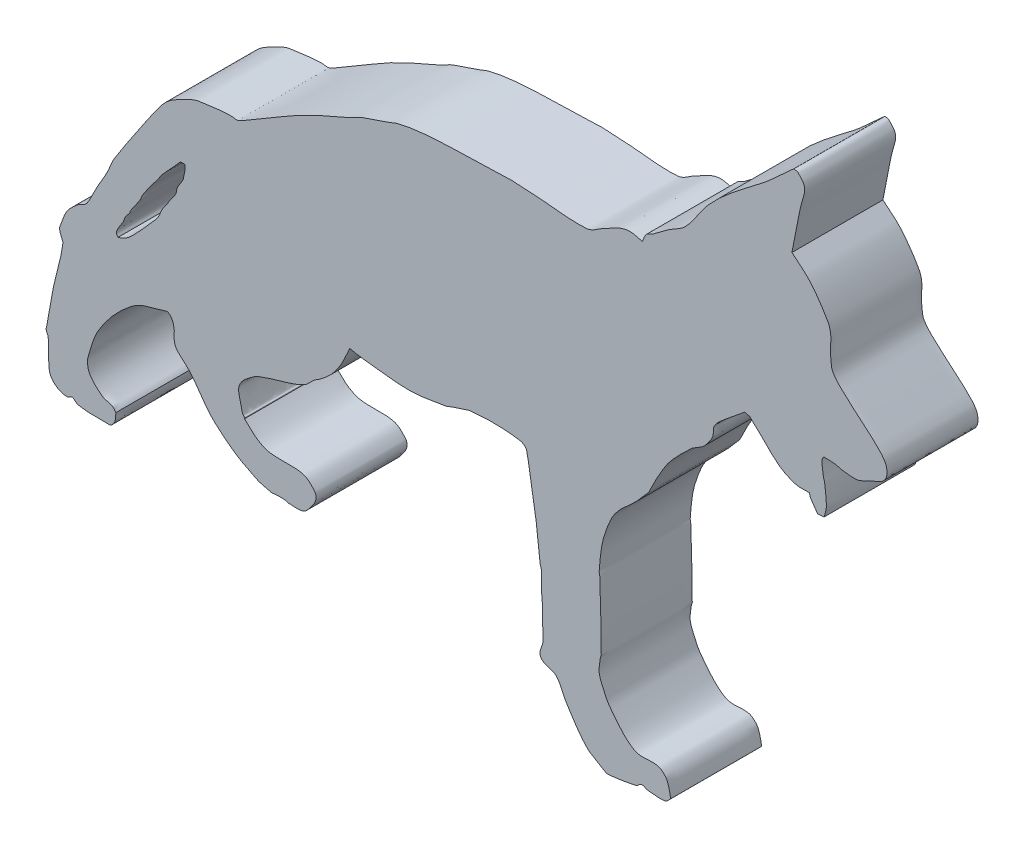
from build123d import *

# Parameters (mm, degrees)
BOSS_EXTRUDE1_DEPTH     = 5
CUT_EXTRUDE1_DEPTH      = 63.844645936
CUT_EXTRUDE1_DEPTH_BACK = 5


with BuildPart() as part:
    # Sketch1 → Boss-Extrude1 (new body)
    with BuildSketch(Plane.XY):
        with BuildLine():
            add(Edge.make_bspline(
                [(7.070233289, 8.254419397), (7.045233289, 8.089419397), (7.069865722, 7.908684262), (6.995233289, 7.759419397), (6.931908728, 7.632770275), (6.81861456, 7.504429793), (6.680233289, 7.474419397), (4.627595112, 7.029268949), (6.124293611, 7.44484249), (5.690233289, 7.504419397), (5.455526628, 7.536634036), (5.212242229, 7.526655534), (4.985233289, 7.594419397), (4.868267752, 7.629334482), (4.785233289, 7.734419397), (4.685233289, 7.804419397)],
                knots=[0, 0, 0, 0, 1, 1, 1, 2, 2, 2, 3, 3, 3, 4, 4, 4, 5, 5, 5, 5], degree=3))
            add(Edge.make_bspline(
                [(4.685233289, 7.804419397), (4.580233289, 7.759419397), (4.484469886, 7.669419397), (4.370233289, 7.669419397), (4.204025588, 7.669419397), (4.032114712, 7.717847681), (3.890233289, 7.804419397), (3.727257476, 7.903862266), (3.572665826, 8.039697414), (3.485233289, 8.209419397), (3.394504703, 8.385539593), (3.395428102, 8.596886823), (3.380233289, 8.794419397), (3.350311823, 9.183398452), (3.388671895, 9.576189473), (3.350233289, 9.964419397), (3.338236704, 10.085584911), (3.253369968, 10.189879888), (3.230233289, 10.309419397), (3.222398485, 10.349899217), (3.252784836, 10.388866708), (3.260233289, 10.429419397), (3.387800639, 11.123952744), (3.508913061, 11.819658143), (3.635233289, 12.514419397), (3.638921107, 12.534702394), (3.645801384, 12.554285887), (3.650233289, 12.574419397), (3.820803206, 13.349294163), (4.071731027, 14.110944698), (4.160233289, 14.899419397), (4.164455373, 14.937034326), (3.910088632, 15.364832547), (3.995233289, 15.574419397), (4.117555829, 15.875521034), (4.193676624, 16.201559095), (4.370233289, 16.474419397), (4.529661574, 16.720808564), (4.761319854, 16.914714959), (4.985233289, 17.104419397), (5.123941211, 17.221935831), (5.337915438, 17.246469404), (5.450233289, 17.389419397), (5.678283937, 17.679665675), (5.796172568, 18.041638886), (5.975233289, 18.364419397), (6.176199178, 18.726686855), (6.397734724, 19.077582508), (6.590233289, 19.444419397), (6.735788265, 19.721797747), (6.815140099, 20.033206627), (6.980233289, 20.299419397), (7.298173363, 20.812097765), (7.633279255, 21.314032567), (7.970233289, 21.814419397), (8.468333303, 22.55411283), (8.952663715, 23.304143472), (9.485233289, 24.019419397), (9.639383145, 24.22645278), (9.820195083, 24.417625474), (10.025233289, 24.574419397), (10.249384405, 24.745829073), (10.508923167, 24.866090824), (10.760233289, 24.994419397), (11.052135873, 25.143476035), (11.349738226, 25.315975098), (11.675233289, 25.354419397), (12.249364544, 25.422230175), (12.82211133, 25.534419397), (13.400233289, 25.534419397), (13.530329407, 25.534419397), (13.668235815, 25.474235147), (13.790233289, 25.519419397), (14.086256081, 25.629057468), (14.340590008, 25.828788204), (14.615233289, 25.984419397), (14.940591344, 26.168788961), (15.266410491, 26.352366476), (15.590233289, 26.539419397), (16.071421338, 26.817372741), (16.538889007, 27.119841285), (17.030233289, 27.379419397), (17.599697762, 27.680268552), (18.185373669, 27.949717292), (18.770233289, 28.219419397), (19.150605648, 28.394824267), (19.545012163, 28.538686943), (19.925233289, 28.714419397), (20.140426079, 28.813878249), (20.334682299, 28.95748689), (20.555233289, 29.044419397), (21.021540661, 29.228219383), (21.507259458, 29.35852559), (21.980233289, 29.524419397), (22.177383756, 29.593569187), (22.362351335, 29.699530392), (22.565233289, 29.749419397), (23.445125525, 29.96578634), (24.359866542, 30.027867323), (25.265233289, 30.064419397), (26.38986143, 30.109823638), (27.515375166, 30.130123043), (28.640233289, 30.169419397), (28.660836249, 30.170139151), (28.679632992, 30.185211716), (28.700233289, 30.184419397), (29.220713127, 30.164400941), (29.740317369, 30.125842886), (30.260233289, 30.094419397), (31.150013002, 30.040641502), (32.042222834, 29.866718482), (32.930233289, 29.944419397), (33.275504604, 29.974630637), (33.551981083, 30.250972001), (33.860233289, 30.409419397), (34.087026304, 30.525995245), (34.306513715, 30.656670311), (34.535233289, 30.769419397), (34.66184163, 30.831831959), (34.789051143, 30.897278811), (34.925233289, 30.934419397), (35.066448482, 30.972932631), (35.214222089, 31.004701875), (35.360233289, 30.994419397), (35.574470026, 30.979332302), (35.780233289, 30.904419397), (35.990233289, 30.859419397)],
                knots=[0, 0, 0, 0, 1, 1, 1, 2, 2, 2, 3, 3, 3, 4, 4, 4, 5, 5, 5, 6, 6, 6, 7, 7, 7, 8, 8, 8, 9, 9, 9, 10, 10, 10, 11, 11, 11, 12, 12, 12, 13, 13, 13, 14, 14, 14, 15, 15, 15, 16, 16, 16, 17, 17, 17, 18, 18, 18, 19, 19, 19, 20, 20, 20, 21, 21, 21, 22, 22, 22, 23, 23, 23, 24, 24, 24, 25, 25, 25, 26, 26, 26, 27, 27, 27, 28, 28, 28, 29, 29, 29, 30, 30, 30, 31, 31, 31, 32, 32, 32, 33, 33, 33, 34, 34, 34, 35, 35, 35, 36, 36, 36, 37, 37, 37, 38, 38, 38, 39, 39, 39, 40, 40, 40, 41, 41, 41, 42, 42, 42, 42], degree=3))
            add(Edge.make_bspline(
                [(35.990233289, 30.859419397), (36.065233289, 31.009419397), (36.102566499, 31.185197038), (36.215233289, 31.309419397), (36.306918185, 31.410507872), (36.462533388, 31.42745361), (36.575233289, 31.504419397), (36.873352019, 31.708012675), (37.149135764, 31.942897593), (37.445233289, 32.149419397), (37.744382282, 32.358069534), (38.107648978, 32.486310739), (38.360233289, 32.749419397), (38.837389729, 33.246457355), (39.151713995, 33.880723677), (39.605233289, 34.399419397), (40.262833198, 35.151524682), (41.065353871, 35.767708268), (41.855233289, 36.379419397), (42.190506462, 36.639067042), (42.537566988, 36.884262244), (42.860233289, 37.159419397), (43.353133782, 37.579745584), (43.816072978, 38.034054676), (44.300233289, 38.464419397), (44.312050868, 38.474923911), (44.329998733, 38.483651218), (44.345233289, 38.479419397), (44.42306383, 38.457799802), (44.515381994, 38.448718094), (44.570233289, 38.389419397), (44.707728811, 38.240775589), (44.881715692, 38.081055451), (44.900233289, 37.879419397), (44.93574678, 37.492716937), (44.73639102, 37.120208052), (44.660233289, 36.739419397), (44.507586857, 35.976187238), (44.349533339, 35.210569669), (44.210233289, 34.444419397)],
                knots=[0, 0, 0, 0, 1, 1, 1, 2, 2, 2, 3, 3, 3, 4, 4, 4, 5, 5, 5, 6, 6, 6, 7, 7, 7, 8, 8, 8, 9, 9, 9, 10, 10, 10, 11, 11, 11, 12, 12, 12, 13, 13, 13, 13], degree=3))
            add(Edge.make_bspline(
                [(44.210233289, 34.444419397), (44.540233289, 34.149419397), (44.91033866, 33.893913199), (45.200233289, 33.559419397), (45.56454484, 33.139059915), (45.879490851, 32.674636726), (46.160233289, 32.194419397), (46.263202525, 32.018287808), (46.318975882, 31.812331009), (46.340233289, 31.609419397), (46.376700388, 31.261324365), (46.281503517, 30.904456806), (46.340233289, 30.559419397), (46.376785056, 30.344677765), (46.347816658, 30.109252659), (46.445233289, 29.914419397), (46.575502242, 29.653881491), (46.790337773, 29.441394327), (47.000233289, 29.239419397), (47.587267141, 28.674537766), (48.254169057, 28.195483629), (48.830233289, 27.619419397), (49.05793924, 27.391713446), (49.321417733, 27.151650254), (49.400233289, 26.839419397), (49.506062446, 26.420173121), (49.354973363, 26.105232348), (49.040233289, 25.954419397), (48.864379164, 25.870155961), (48.677648004, 25.810345407), (48.500233289, 25.729419397), (48.392389985, 25.680227714), (48.294182027, 25.611111713), (48.185233289, 25.564419397), (48.048592557, 25.505859083), (47.913507063, 25.425137983), (47.765233289, 25.414419397), (47.490224599, 25.39453925), (47.213776808, 25.439793635), (46.940233289, 25.474419397), (46.817519341, 25.489952808), (46.703027676, 25.549535228), (46.580233289, 25.564419397), (46.371522964, 25.589717618), (46.160233289, 25.584419397), (45.950233289, 25.594419397)],
                knots=[0, 0, 0, 0, 1, 1, 1, 2, 2, 2, 3, 3, 3, 4, 4, 4, 5, 5, 5, 6, 6, 6, 7, 7, 7, 8, 8, 8, 9, 9, 9, 10, 10, 10, 11, 11, 11, 12, 12, 12, 13, 13, 13, 14, 14, 14, 15, 15, 15, 15], degree=3))
            add(Edge.make_bspline(
                [(45.950233289, 25.594419397), (45.920233289, 25.524419397), (45.86146148, 25.460567223), (45.860233289, 25.384419397), (45.856341883, 25.143152207), (45.900125797, 24.903150341), (45.935233289, 24.664419397), (45.950230466, 24.562438591), (45.99799595, 24.466768053), (46.010233289, 24.364419397), (46.053120499, 24.00572637), (46.106921917, 23.645605307), (46.100233289, 23.284419397), (46.096819228, 23.100060116), (46.020233289, 22.924419397), (45.980233289, 22.744419397)],
                knots=[0, 0, 0, 0, 1, 1, 1, 2, 2, 2, 3, 3, 3, 4, 4, 4, 5, 5, 5, 5], degree=3))
            Line((45.980233289, 22.744419397), (45.620233289, 22.714419397))
            add(Edge.make_bspline(
                [(45.620233289, 22.714419397), (45.490233289, 22.904419397), (45.345278037, 23.085008499), (45.230233289, 23.284419397), (45.193852945, 23.347478659), (45.190233289, 23.424419397), (45.170233289, 23.494419397)],
                knots=[0, 0, 0, 0, 1, 1, 1, 2, 2, 2, 2], degree=3))
            add(Edge.make_bspline(
                [(45.170233289, 23.494419397), (44.915233289, 23.504419397), (44.649957629, 23.452066114), (44.405233289, 23.524419397), (44.062143114, 23.625854753), (43.727917053, 23.785125325), (43.445233289, 24.004419397), (42.894733762, 24.431473575), (42.462599432, 24.994962735), (41.930233289, 25.444419397), (41.84566308, 25.515818835), (41.720233289, 25.514419397), (41.615233289, 25.549419397)],
                knots=[0, 0, 0, 0, 1, 1, 1, 2, 2, 2, 3, 3, 3, 4, 4, 4, 4], degree=3))
            add(Edge.make_bspline(
                [(41.615233289, 25.549419397), (41.325233289, 25.314419397), (41.025194009, 25.091293849), (40.745233289, 24.844419397), (40.474699682, 24.605857943), (40.162268678, 24.396540325), (39.965233289, 24.094419397), (39.848454576, 23.915358703), (39.933344716, 23.659192024), (39.845233289, 23.464419397), (39.738865227, 23.229289995), (39.56750647, 23.026570252), (39.395233289, 22.834419397), (39.304437351, 22.733147004), (39.178025718, 22.670431685), (39.065233289, 22.594419397), (38.947884032, 22.515336201), (38.808717796, 22.465938601), (38.705233289, 22.369419397), (38.286350816, 21.978730936), (37.868434166, 21.582347295), (37.505233289, 21.139419397), (37.250159061, 20.828353265), (37.062573404, 20.46710241), (36.860233289, 20.119419397), (36.707254912, 19.856555143), (36.580787408, 19.579131354), (36.440233289, 19.309419397), (36.395786174, 19.224128987), (36.365919191, 19.129033211), (36.305233289, 19.054419397), (36.059474116, 18.752256479), (35.797981307, 18.462463492), (35.525233289, 18.184419397), (35.282398249, 17.936869113), (34.99251981, 17.736893613), (34.760233289, 17.479419397), (34.575293574, 17.274425978), (34.398502546, 17.05389361), (34.280233289, 16.804419397), (34.075642634, 16.372860984), (33.908524313, 15.919578567), (33.800233289, 15.454419397), (33.68717505, 14.968782871), (33.66663139, 14.465879079), (33.620233289, 13.969419397), (33.616396638, 13.928367233), (33.648955421, 13.890630646), (33.650233289, 13.849419397), (33.688985515, 12.599660114), (33.730832352, 11.349744003), (33.740233289, 10.099419397), (33.740853287, 10.016959615), (33.690786076, 9.941203495), (33.680233289, 9.859419397), (33.650688812, 9.630449696), (33.596203917, 9.399033397), (33.620233289, 9.169419397), (33.642121625, 8.960264189), (33.729444551, 8.761422762), (33.815233289, 8.569419397), (33.940255438, 8.28960792), (34.056345822, 7.996764399), (34.250233289, 7.759419397), (34.641667951, 7.280249379), (35.01362623, 6.73856283), (35.555233289, 6.439419397), (35.928518533, 6.233244407), (36.41403693, 6.42732037), (36.830233289, 6.334419397), (36.988586113, 6.299072784), (37.123408488, 6.181978803), (37.235233289, 6.064419397), (37.324632046, 5.970436088), (37.374215001, 5.842474262), (37.415233289, 5.719419397), (37.480059981, 5.52493932), (37.505233289, 5.319419397), (37.550233289, 5.119419397)],
                knots=[0, 0, 0, 0, 1, 1, 1, 2, 2, 2, 3, 3, 3, 4, 4, 4, 5, 5, 5, 6, 6, 6, 7, 7, 7, 8, 8, 8, 9, 9, 9, 10, 10, 10, 11, 11, 11, 12, 12, 12, 13, 13, 13, 14, 14, 14, 15, 15, 15, 16, 16, 16, 17, 17, 17, 18, 18, 18, 19, 19, 19, 20, 20, 20, 21, 21, 21, 22, 22, 22, 23, 23, 23, 24, 24, 24, 25, 25, 25, 26, 26, 26, 26], degree=3))
            add(Edge.make_bspline(
                [(37.550233289, 5.119419397), (37.445233289, 5.034419397), (37.368172347, 4.888444527), (37.235233289, 4.864419397), (36.930016304, 4.8092597), (36.61370994, 4.862136956), (36.305233289, 4.894419397), (36.180912209, 4.907429742), (36.06908706, 5.016308547), (35.945233289, 4.999419397), (35.827058358, 4.983304633), (35.761368139, 4.831579966), (35.645233289, 4.804419397), (35.132939053, 4.684608648), (34.610204997, 4.59912827), (34.085233289, 4.564419397), (33.99149647, 4.558221921), (33.910239324, 4.635184913), (33.830233289, 4.684419397), (33.519611422, 4.875571315), (33.166388064, 5.019945808), (32.915233289, 5.284419397), (32.495772834, 5.726123966), (32.182525281, 6.258898063), (31.850233289, 6.769419397), (31.631671118, 7.105210369), (31.542246252, 7.529956413), (31.265233289, 7.819419397), (31.074972894, 8.01823082), (30.726927578, 7.988605495), (30.515233289, 8.164419397), (30.171862853, 8.449591454), (30.527925146, 8.804744506), (30.530233289, 9.109419397), (30.534779244, 9.709485505), (30.518976743, 10.309628864), (30.500233289, 10.909419397), (30.498945447, 10.950630335), (30.471817927, 10.988218803), (30.470233289, 11.029419397), (30.451781388, 11.509168839), (30.465916327, 11.990002687), (30.440233289, 12.469419397), (30.435822001, 12.551763434), (30.390803728, 12.627637578), (30.380233289, 12.709419397), (30.295723228, 13.363260394), (30.232827102, 14.019721603), (30.155233289, 14.674419397), (30.152806949, 14.694891643), (30.143566532, 14.714075122), (30.140233289, 14.734419397), (29.998554906, 15.599146079), (29.863514378, 16.46495683), (29.720233289, 17.329419397), (29.713491391, 17.370095517), (29.70078401, 17.409561119), (29.690233289, 17.449419397), (29.655782699, 17.579566071), (29.669005468, 17.734028591), (29.585233289, 17.839419397), (29.500313492, 17.94625398), (29.359909056, 18.012341402), (29.225233289, 18.034419397), (28.740455768, 18.113891121), (28.24645204, 18.134021388), (27.755233289, 18.139419397), (27.334515301, 18.144042671), (26.915002108, 18.093039998), (26.495233289, 18.064419397), (26.474665513, 18.063017048), (26.454790896, 18.055938599), (26.435233289, 18.049419397), (26.259726879, 17.99091726), (26.086750389, 17.92479731), (25.910233289, 17.869419397), (25.831552354, 17.844735182), (25.748463718, 17.835496206), (25.670233289, 17.809419397), (25.488677513, 17.748900804), (25.319778545, 17.64083144), (25.130233289, 17.614419397), (24.540531804, 17.532247878), (23.95540091, 17.391017697), (23.360233289, 17.374419397), (22.653365989, 17.354705966), (21.946097433, 17.445401036), (21.245233289, 17.539419397), (20.804406769, 17.598554661), (20.352895318, 17.612230245), (19.925233289, 17.734419397)],
                knots=[0, 0, 0, 0, 1, 1, 1, 2, 2, 2, 3, 3, 3, 4, 4, 4, 5, 5, 5, 6, 6, 6, 7, 7, 7, 8, 8, 8, 9, 9, 9, 10, 10, 10, 11, 11, 11, 12, 12, 12, 13, 13, 13, 14, 14, 14, 15, 15, 15, 16, 16, 16, 17, 17, 17, 18, 18, 18, 19, 19, 19, 20, 20, 20, 21, 21, 21, 22, 22, 22, 23, 23, 23, 24, 24, 24, 25, 25, 25, 26, 26, 26, 27, 27, 27, 28, 28, 28, 29, 29, 29, 30, 30, 30, 30], degree=3))
            add(Edge.make_bspline(
                [(19.925233289, 17.734419397), (19.735534522, 17.322030772), (19.567159097, 16.893637421), (19.310233289, 16.519419397), (19.181163948, 16.331427096), (19.048011987, 16.144058038), (18.890233289, 15.979419397), (18.701474962, 15.782454186), (18.489626353, 15.608122135), (18.275233289, 15.439419397), (18.183585759, 15.367303308), (18.066604035, 15.33188585), (17.975233289, 15.259419397), (17.775479791, 15.100994209), (17.629770814, 14.870179074), (17.405233289, 14.749419397), (16.78135829, 14.413889985), (16.063227301, 14.295181989), (15.395233289, 14.059419397), (15.14569695, 13.971347747), (14.876421263, 13.912022672), (14.660233289, 13.759419397), (14.356935689, 13.545326973), (14.014036438, 13.319540879), (13.865233289, 12.979419397), (13.744720723, 12.703962102), (13.866267849, 12.374246595), (13.925233289, 12.079419397), (14.089281298, 11.259179353), (14.20388977, 11.76904532), (14.135233289, 11.494419397)],
                knots=[0, 0, 0, 0, 1, 1, 1, 2, 2, 2, 3, 3, 3, 4, 4, 4, 5, 5, 5, 6, 6, 6, 7, 7, 7, 8, 8, 8, 9, 9, 9, 10, 10, 10, 10], degree=3))
            add(Edge.make_bspline(
                [(14.135233289, 11.494419397), (14.365233289, 11.289419397), (14.568450824, 11.049677335), (14.825233289, 10.879419397), (15.034259325, 10.740826047), (15.267649529, 10.619447909), (15.515233289, 10.579419397), (16.113476438, 10.48269745), (16.742106655, 10.620559954), (17.330233289, 10.474419397), (17.60005674, 10.407372357), (17.814772813, 10.180089565), (17.990233289, 9.964419397), (18.070122582, 9.866222141), (18.077694492, 9.712994808), (18.050233289, 9.589419397), (18.014308531, 9.427757986), (17.91313933, 9.284170492), (17.810233289, 9.154419397), (17.68059391, 8.990961049), (17.555956681, 8.791650648), (17.360233289, 8.719419397), (17.106758498, 8.625875128), (16.820308199, 8.681702971), (16.550233289, 8.689419397), (16.467804814, 8.691774496), (16.392607712, 8.7456175), (16.310233289, 8.749419397), (15.516786611, 8.786040012), (15.816150695, 8.670607695), (15.515233289, 8.749419397), (15.325174803, 8.799196619), (15.129951438, 8.832492531), (14.945233289, 8.899419397), (14.783340217, 8.958076307), (14.633097299, 9.045156577), (14.480233289, 9.124419397), (14.228003182, 9.255205378), (13.96795814, 9.373817676), (13.730233289, 9.529419397), (13.41647022, 9.734791587), (13.116714038, 9.962440512), (12.830233289, 10.204419397), (12.600635258, 10.398351714), (12.377805655, 10.603679535), (12.185233289, 10.834419397), (11.82128558, 11.270500886), (11.530637778, 11.764557856), (11.165233289, 12.199419397), (10.924139656, 12.486340745), (10.575777788, 12.681048276), (10.370233289, 12.994419397), (10.258368953, 13.164966663), (10.27553151, 13.392033626), (10.250233289, 13.594419397), (10.245119206, 13.635332062), (10.283754468, 13.673338972), (10.280233289, 13.714419397), (10.261390133, 13.93425622), (10.223826855, 14.183883892), (10.070233289, 14.359419397), (10.022747847, 14.413688474), (9.950233289, 14.439419397), (9.890233289, 14.479419397)],
                knots=[0, 0, 0, 0, 1, 1, 1, 2, 2, 2, 3, 3, 3, 4, 4, 4, 5, 5, 5, 6, 6, 6, 7, 7, 7, 8, 8, 8, 9, 9, 9, 10, 10, 10, 11, 11, 11, 12, 12, 12, 13, 13, 13, 14, 14, 14, 15, 15, 15, 16, 16, 16, 17, 17, 17, 18, 18, 18, 19, 19, 19, 20, 20, 20, 21, 21, 21, 21], degree=3))
            add(Edge.make_bspline(
                [(9.890233289, 14.479419397), (9.610233289, 14.394419397), (9.330763275, 14.307653568), (9.050233289, 14.224419397), (8.875748754, 14.17264926), (8.691727348, 14.147936254), (8.525233289, 14.074419397), (8.303975417, 13.976721115), (8.084617179, 13.864864543), (7.895233289, 13.714419397), (7.54624618, 13.437186646), (7.214955313, 13.133767911), (6.920233289, 12.799419397), (6.617352975, 12.455815678), (6.343251307, 12.083757581), (6.110233289, 11.689419397), (5.900032026, 11.333694181), (5.768378426, 10.933204589), (5.660233289, 10.534419397), (5.606275655, 10.335450621), (5.512842641, 10.140558164), (5.510233289, 9.934419397), (5.507700265, 9.734310467), (5.538443781, 9.518670692), (5.645233289, 9.349419397), (5.813152255, 9.083283677), (6.04979866, 8.858207727), (6.305233289, 8.674419397), (6.469594479, 8.556159516), (6.697739661, 8.561866879), (6.875233289, 8.464419397), (6.958968338, 8.418447213), (7.005233289, 8.324419397), (7.070233289, 8.254419397)],
                knots=[0, 0, 0, 0, 1, 1, 1, 2, 2, 2, 3, 3, 3, 4, 4, 4, 5, 5, 5, 6, 6, 6, 7, 7, 7, 8, 8, 8, 9, 9, 9, 10, 10, 10, 11, 11, 11, 11], degree=3))
        make_face()
        with BuildLine():
            add(Edge.make_bspline(
                [(7.190233289, 16.654419397), (7.160233289, 16.704419397), (7.098353315, 16.746140192), (7.100233289, 16.804419397), (7.108939493, 17.074311715), (7.364798884, 17.31273825), (7.475233289, 17.539419397), (7.52240404, 17.636243569), (7.540521628, 17.74664745), (7.595233289, 17.839419397), (7.656718366, 17.9436767), (7.754781513, 18.022605522), (7.820233289, 18.124419397), (7.845883674, 18.164319995), (7.841699353, 18.218235008), (7.865233289, 18.259419397), (8.027619344, 18.543594992), (8.250054884, 18.789840588), (8.420233289, 19.069419397), (8.450662404, 19.119410085), (8.452404368, 19.182935893), (8.480233289, 19.234419397), (8.73042485, 19.697273784), (9.07181162, 20.087368692), (9.380233289, 20.509419397), (9.450603744, 20.605715809), (9.499607502, 20.717192826), (9.575233289, 20.809419397), (9.705335543, 20.968080682), (9.857519573, 21.10731768), (9.995233289, 21.259419397), (10.192546355, 21.477347261), (10.370180591, 21.713742796), (10.580233289, 21.919419397), (10.614125495, 21.952605514), (10.667864686, 21.961926312), (10.715233289, 21.964419397), (10.766153007, 21.967099382), (10.85209502, 21.983687905), (10.865233289, 21.934419397)],
                knots=[0, 0, 0, 0, 1, 1, 1, 2, 2, 2, 3, 3, 3, 4, 4, 4, 5, 5, 5, 6, 6, 6, 7, 7, 7, 8, 8, 8, 9, 9, 9, 10, 10, 10, 11, 11, 11, 12, 12, 12, 13, 13, 13, 13], degree=3))
            add(Edge.make_bspline(
                [(10.865233289, 21.934419397), (10.901397966, 21.79880186), (10.852642394, 21.653692233), (10.835233289, 21.514419397), (10.832459788, 21.492231389), (10.809618579, 21.476345847), (10.805233289, 21.454419397), (10.789421901, 21.375362455), (10.807977219, 21.288093239), (10.775233289, 21.214419397), (10.686067626, 21.013796655), (10.536820356, 20.843948365), (10.445233289, 20.644419397), (10.395653479, 20.536406238), (10.409152903, 20.405332924), (10.355233289, 20.299419397), (10.267143977, 20.126386819), (10.13140049, 19.981987922), (10.025233289, 19.819419397), (9.971311475, 19.736851619), (9.929935279, 19.646472381), (9.875233289, 19.564419397), (9.799785906, 19.451248321), (9.703145244, 19.352266613), (9.635233289, 19.234419397), (9.53251238, 19.056168408), (9.478215879, 18.851349424), (9.365233289, 18.679419397), (9.246396219, 18.498580377), (9.088008226, 18.347024186), (8.945233289, 18.184419397), (8.727974278, 17.936985523), (8.512250845, 17.687931512), (8.285233289, 17.449419397), (7.949145089, 17.096314072), (7.671183563, 16.765407921), (7.190233289, 16.654419397)],
                knots=[13, 13, 13, 13, 14, 14, 14, 15, 15, 15, 16, 16, 16, 17, 17, 17, 18, 18, 18, 19, 19, 19, 20, 20, 20, 21, 21, 21, 22, 22, 22, 23, 23, 23, 24, 24, 24, 25, 25, 25, 25], degree=3))
        make_face(mode=Mode.SUBTRACT)
    extrude(amount=BOSS_EXTRUDE1_DEPTH)

    # Sketch2 → Cut-Extrude1 (cut, two sides: drawn at the far end of the back side and taken through both)
    with BuildSketch(Plane(origin=(0, 0, 0), x_dir=(-1, 0, 0), z_dir=(0, 0, -1)).offset(-CUT_EXTRUDE1_DEPTH_BACK)):
        with BuildLine():
            add(Edge.make_bspline(
                [(-6.753689986, 7.500238358), (-6.730150689, 7.488735663), (-6.70561395, 7.479923636), (-6.680233289, 7.474419397), (-4.627595112, 7.029268949), (-6.124293611, 7.44484249), (-5.690233289, 7.504419397), (-5.662563262, 7.508217243), (-5.634774017, 7.511428668), (-5.606906276, 7.514250188)],
                knots=[1.816588905, 1.816588905, 1.816588905, 1.816588905, 2, 2, 2, 3, 3, 3, 3.117891955, 3.117891955, 3.117891955, 3.117891955], degree=3))
            Line((-5.606906276, 7.514250188), (-6.753689986, 7.500238358))
        make_face()
    extrude(amount=CUT_EXTRUDE1_DEPTH + CUT_EXTRUDE1_DEPTH_BACK, mode=Mode.SUBTRACT)


solid = part.part
